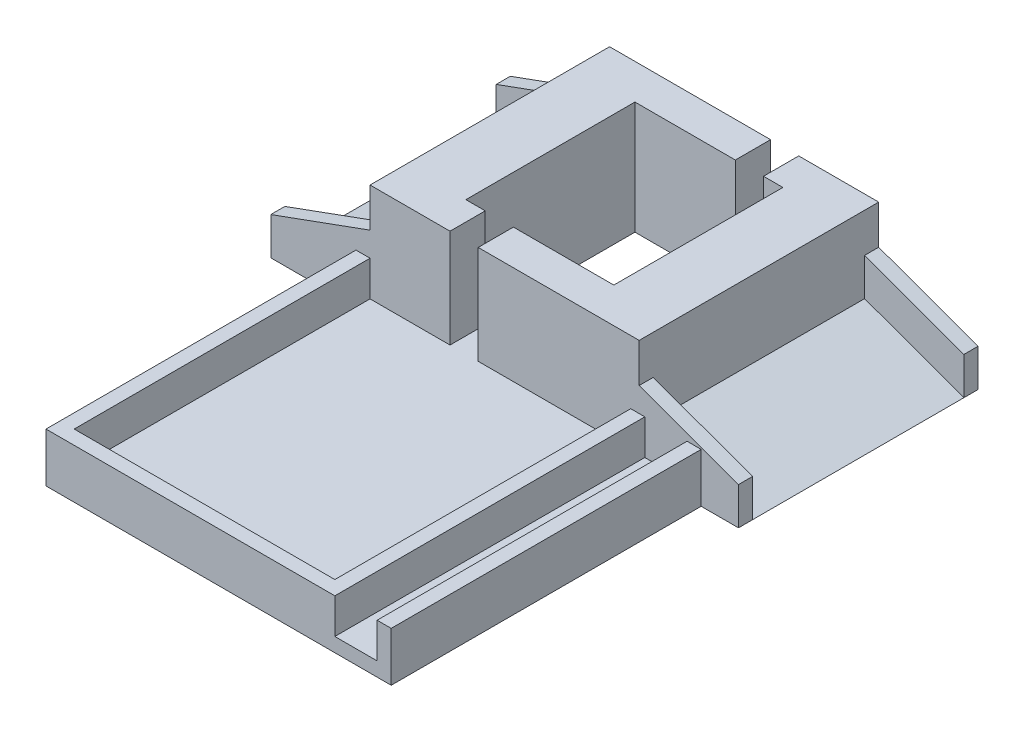
from build123d import *

# Parameters (mm, degrees)
BOSS_EXTRUDE1_DEPTH            = 34
BOSS_EXTRUDE1_2_DEPTH          = 34
SKETCH5_W                      = 38.2
SKETCH5_H                      = 34
BOSS_EXTRUDE2_DEPTH            = 16
BOSS_EXTRUDE7_REACH            = 77.954
SKETCH12_W                     = 2
SKETCH12_H                     = 5
BOSS_EXTRUDE8_REACH            = 79.938
SKETCH13_W                     = 2
SKETCH13_H                     = 5
CUT_EXTRUDE1_START             = 2
SKETCH6_W                      = 4
SKETCH6_H                      = 5
CUT_EXTRUDE1_DEPTH             = 14
SKETCH7_W                      = 49
SKETCH7_H                      = 44
BOSS_EXTRUDE3_DEPTH            = 2
SKETCH8_W                      = 10
SKETCH8_H                      = 5
SKETCH8_W_2                    = 2
BOSS_EXTRUDE5_DEPTH            = 45
CUT_EXTRUDE2_REACH             = 97.297
SKETCH9_W                      = 6
SKETCH9_H                      = 44
CUT_EXTRUDE2_DIRECTION_2_REACH = 97.297
SKETCH10_W                     = 21
SKETCH10_H                     = 24
CUT_EXTRUDE3_DEPTH             = 16
SKETCH11_W                     = 2
SKETCH11_H                     = 5
BOSS_EXTRUDE6_DEPTH            = 37
SKETCH14_W                     = 5
SKETCH14_H                     = 34
CUT_EXTRUDE4_DEPTH             = 5.320889


with BuildPart() as part:
    # Sketch4 → Boss-Extrude1 (new body)
    with BuildSketch(Plane.XY):
        Polygon((0, 0), (-14.095389312, 0), (0, 5.13030215), align=None)
    extrude(amount=BOSS_EXTRUDE1_DEPTH)



with BuildPart() as body_2:
    # Sketch4 → Boss-Extrude1 2 (new body)
    with BuildSketch(Plane.XY):
        Polygon((52.295389312, 0), (38.2, 5.13030215), (38.2, 0), align=None)
    extrude(amount=BOSS_EXTRUDE1_2_DEPTH)


with BuildPart() as part_1:
    add(part.part)

    add(body_2.part)  # Boss-Extrude2 merges body 2
    # Sketch5 → Boss-Extrude2 (add)
    with BuildSketch(Plane(origin=(0, 0, 0), x_dir=(1, 0, 0), z_dir=(0, 1, 0))):
        with Locations((19.1, -17)):
            Rectangle(SKETCH5_W, SKETCH5_H)
    extrude(amount=BOSS_EXTRUDE2_DEPTH)

    # Boss-Extrude7: up to this plane
    boss_extrude7_end = Plane(origin=(0, 16, 0), z_dir=(1, 0, 0))
    # Sketch12 → Boss-Extrude7 (add, up to the surface)
    with BuildSketch(Plane(origin=(-12.446541984, -4.530170802, 0), x_dir=(0, 0, -1), z_dir=(0.9396926207859105, 0.3420201433256627, 0)), mode=Mode.PRIVATE) as boss_extrude7_sk1:
        with Locations((-1, 7.320907073)):
            Rectangle(SKETCH12_W, SKETCH12_H)
    boss_extrude7_tool1 = split(extrude(boss_extrude7_sk1.sketch, amount=BOSS_EXTRUDE7_REACH, mode=Mode.PRIVATE), bisect_by=boss_extrude7_end, keep=Keep.BOTH, mode=Mode.PRIVATE)
    add(boss_extrude7_tool1.solids().sort_by_distance((-14.95044, 2.349232, 1))[0])
    # Sketch12 → Boss-Extrude7 (add, up to the surface)
    with BuildSketch(Plane(origin=(-12.446541984, -4.530170802, 0), x_dir=(0, 0, -1), z_dir=(0.9396926207859105, 0.3420201433256627, 0)), mode=Mode.PRIVATE) as boss_extrude7_sk2:
        with Locations((-33, 7.320907073)):
            Rectangle(SKETCH12_W, SKETCH12_H)
    boss_extrude7_tool2 = split(extrude(boss_extrude7_sk2.sketch, amount=BOSS_EXTRUDE7_REACH, mode=Mode.PRIVATE), bisect_by=boss_extrude7_end, keep=Keep.BOTH, mode=Mode.PRIVATE)
    add(boss_extrude7_tool2.solids().sort_by_distance((-14.95044, 2.349232, 33))[0])

    # Boss-Extrude8: up to this plane
    boss_extrude8_end = Plane(origin=(38.2, 16, 0), z_dir=(-1, 0, 0))
    # Sketch13 → Boss-Extrude8 (add, up to the surface)
    with BuildSketch(Plane(origin=(46.177990847, -16.807414147, 0), x_dir=(0, 0, -1), z_dir=(0.9396926207859105, -0.3420201433256628, 0)), mode=Mode.PRIVATE) as boss_extrude8_sk1:
        with Locations((-33, 20.386076548)):
            Rectangle(SKETCH13_W, SKETCH13_H)
    boss_extrude8_tool1 = split(extrude(boss_extrude8_sk1.sketch, amount=-BOSS_EXTRUDE8_REACH, mode=Mode.PRIVATE), bisect_by=boss_extrude8_end, keep=Keep.BOTH, mode=Mode.PRIVATE)
    add(boss_extrude8_tool1.solids().sort_by_distance((53.15044, 2.349232, 33))[0])
    # Sketch13 → Boss-Extrude8 (add, up to the surface)
    with BuildSketch(Plane(origin=(46.177990847, -16.807414147, 0), x_dir=(0, 0, -1), z_dir=(0.9396926207859105, -0.3420201433256628, 0)), mode=Mode.PRIVATE) as boss_extrude8_sk2:
        with Locations((-1, 20.386076548)):
            Rectangle(SKETCH13_W, SKETCH13_H)
    boss_extrude8_tool2 = split(extrude(boss_extrude8_sk2.sketch, amount=-BOSS_EXTRUDE8_REACH, mode=Mode.PRIVATE), bisect_by=boss_extrude8_end, keep=Keep.BOTH, mode=Mode.PRIVATE)
    add(boss_extrude8_tool2.solids().sort_by_distance((53.15044, 2.349232, 1))[0])

    # Sketch6 → Cut-Extrude1 (cut)
    with BuildSketch(Plane(origin=(0, 0, 0), x_dir=(1, 0, 0), z_dir=(0, 1, 0)).offset(CUT_EXTRUDE1_START)):
        with Locations((13.35, -31.5)):
            Rectangle(SKETCH6_W, SKETCH6_H)
        with Locations((24.85, -2.5)):
            Rectangle(SKETCH6_W, SKETCH6_H)
    extrude(amount=CUT_EXTRUDE1_DEPTH, mode=Mode.SUBTRACT)

    # Sketch7 → Boss-Extrude3 (add)
    with BuildSketch(Plane(origin=(0, 0, 0), x_dir=(1, 0, 0), z_dir=(0, 1, 0))):
        with Locations((22.5, -56)):
            Rectangle(SKETCH7_W, SKETCH7_H)
    extrude(amount=BOSS_EXTRUDE3_DEPTH)

    # Sketch8 → Boss-Extrude5 (add)
    with BuildSketch(Plane.XY.offset(78)):
        with Locations((42, 4.5)):
            Rectangle(SKETCH8_W, SKETCH8_H)
        with Locations((-1, 4.5)):
            Rectangle(SKETCH8_W_2, SKETCH8_H)
    extrude(amount=-BOSS_EXTRUDE5_DEPTH)

    # Cut-Extrude2: up to this face of the body (flat: up to its plane)
    cut_extrude2_end = Plane(part_1.part.faces().sort_by_distance((18.4375, 2, 55.702669903))[0])
    # Sketch9 → Cut-Extrude2 (cut, up to the picked face)
    with BuildSketch(Plane(origin=(0, 7, 0), x_dir=(1, 0, 0), z_dir=(0, 1, 0)), mode=Mode.PRIVATE) as cut_extrude2_sk1:
        with Locations((42, -56)):
            Rectangle(SKETCH9_W, SKETCH9_H)
    cut_extrude2_tool1 = split(extrude(cut_extrude2_sk1.sketch, amount=-CUT_EXTRUDE2_REACH, mode=Mode.PRIVATE), bisect_by=cut_extrude2_end, keep=Keep.BOTH, mode=Mode.PRIVATE)
    add(cut_extrude2_tool1.solids().sort_by(Axis((42, 7, 56), (0, -1, 0)))[0], mode=Mode.SUBTRACT)

    # Cut-Extrude2 direction 2: up to this face of the body (flat: up to its plane)
    cut_extrude2_direction_2_end = Plane(part_1.part.faces().sort_by_distance((46.102745014, 7.574827058, 33))[0])
    # Sketch9 → Cut-Extrude2 direction 2 (cut, up to the picked face)
    with BuildSketch(Plane(origin=(0, 7, 0), x_dir=(1, 0, 0), z_dir=(0, 1, 0)), mode=Mode.PRIVATE) as cut_extrude2_direction_2_sk1:
        with Locations((42, -56)):
            Rectangle(SKETCH9_W, SKETCH9_H)
    cut_extrude2_direction_2_tool1 = split(extrude(cut_extrude2_direction_2_sk1.sketch, amount=CUT_EXTRUDE2_DIRECTION_2_REACH, mode=Mode.PRIVATE), bisect_by=cut_extrude2_direction_2_end, keep=Keep.BOTH, mode=Mode.PRIVATE)
    add(cut_extrude2_direction_2_tool1.solids().sort_by(Axis((42, 7, 56), (0, 1, 0)))[0], mode=Mode.SUBTRACT)

    # Sketch10 → Cut-Extrude3 (cut)
    with BuildSketch(Plane(origin=(0, 16, 0), x_dir=(1, 0, 0), z_dir=(0, 1, 0))):
        with Locations((19.1, -17)):
            Rectangle(SKETCH10_W, SKETCH10_H)
    extrude(amount=-CUT_EXTRUDE3_DEPTH, mode=Mode.SUBTRACT)

    # Sketch11 → Boss-Extrude6 (add)
    with BuildSketch(Plane(origin=(0, 0, 0), x_dir=(0, 0, -1), z_dir=(1, 0, 0))):
        with Locations((-77, 4.5)):
            Rectangle(SKETCH11_W, SKETCH11_H)
    extrude(amount=BOSS_EXTRUDE6_DEPTH)

    # Sketch14 → Cut-Extrude4 (cut)
    with BuildSketch(Plane(origin=(0, 0, 0), x_dir=(1, 0, 0), z_dir=(0, 1, 0))):
        with Locations((-16.595389312, -17)):
            Rectangle(SKETCH14_W, SKETCH14_H)
        with Locations((54.795389312, -17)):
            Rectangle(SKETCH14_W, SKETCH14_H)
    extrude(amount=CUT_EXTRUDE4_DEPTH, mode=Mode.SUBTRACT)


solid = part_1.part
